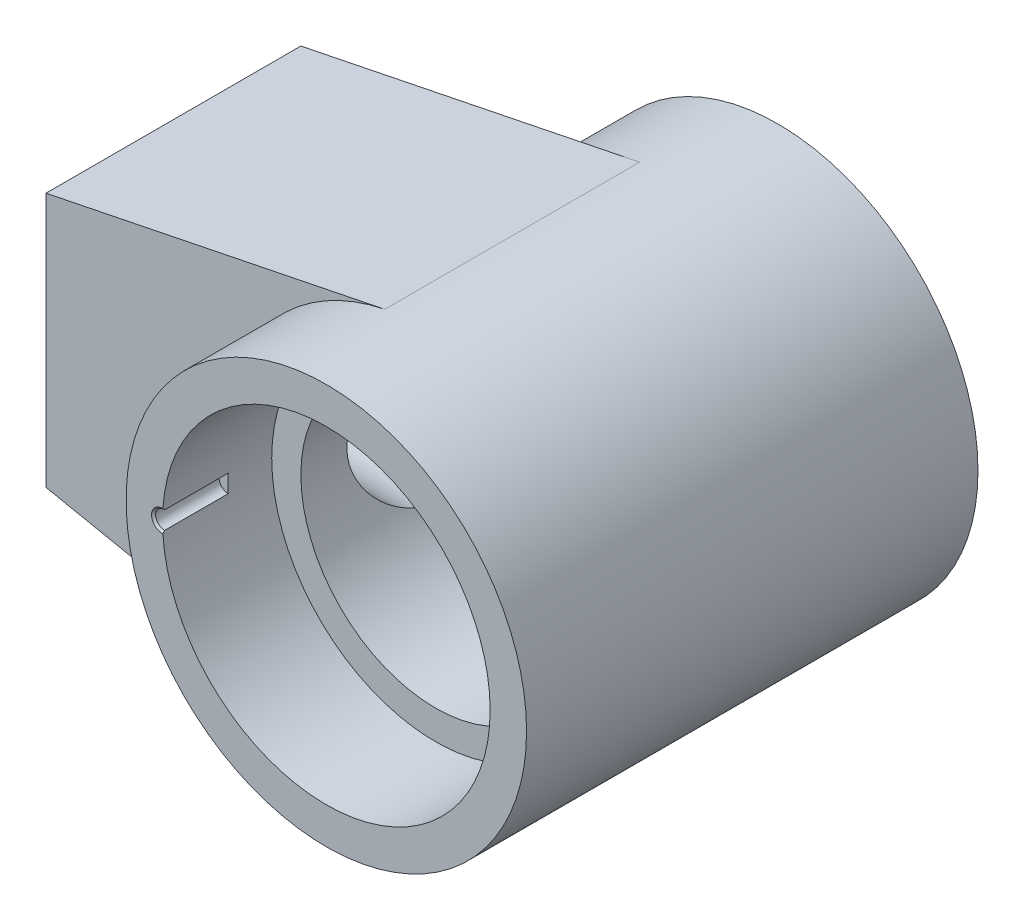
from build123d import *

# Parameters (mm, degrees)
SKETCH_1_R               = 55
EXTRUDE_1_DEPTH          = 62
EXTRUDE_2_DEPTH          = 35
CUT_EXTRUDE_1_DEPTH      = 133.984961556
CUT_EXTRUDE_1_DEPTH_BACK = 133.984961556
SKETCH_3_R               = 37
SKETCH_4_R               = 45
CUT_EXTRUDE_2_DEPTH      = 30
CUT_EXTRUDE_3_REACH      = 181.304
CUT_EXTRUDE_3_END_RADIUS = 37
SKETCH_6_R               = 19.352
CHAMFER_2_SIZE           = 1.648
SKETCH_9_R               = 2.4455
CUT_EXTRUDE_5_DEPTH      = 18
CHAMFER_3_SIZE           = 0.5545


with BuildPart() as part:
    # Эскиз1 → Бобышка-Вытянуть1 (new, symmetric)
    with BuildSketch(Plane.XY):
        Circle(SKETCH_1_R)
    extrude(amount=EXTRUDE_1_DEPTH, both=True)

    # Эскиз2 → Бобышка-Вытянуть2 (add, symmetric)
    with BuildSketch(Plane.XY):
        Polygon((-104, 0), (-104, 35), (-10.947280704, 53.899508766), (-10.947280704, 0), align=None)
    extrude_2 = extrude(amount=EXTRUDE_2_DEPTH, both=True)

    # Зеркальное отражение1: Бобышка-Вытянуть2 across plane
    add(extrude_2.mirror(Plane(origin=(-104, 0, 35), x_dir=(0, 0, 1), z_dir=(0, 1, 0))))

    # Эскиз3 → Вырез-Вытянуть1 (cut, two sides: drawn at the far end of the back side and taken through both)
    with BuildSketch(Plane.XY.offset(-CUT_EXTRUDE_1_DEPTH_BACK)):
        Circle(SKETCH_3_R)
    extrude(amount=CUT_EXTRUDE_1_DEPTH + CUT_EXTRUDE_1_DEPTH_BACK, mode=Mode.SUBTRACT)

    # Эскиз4 → Вырез-Вытянуть2 (cut)
    with BuildSketch(Plane.XY.offset(62)):
        Circle(SKETCH_4_R)
    cut_extrude_2 = extrude(amount=-CUT_EXTRUDE_2_DEPTH, mode=Mode.SUBTRACT)

    # Зеркальное отражение2: Вырез-Вытянуть2 across plane
    add(cut_extrude_2.mirror(Plane.XY), mode=Mode.SUBTRACT)

    # Вырез-Вытянуть3: up to this cylinder (the profile starts outside it)
    cut_extrude_3_end = Plane(origin=(0, 0, 0), z_dir=(0, 0, 1)) * Cylinder(CUT_EXTRUDE_3_END_RADIUS, 437.608, mode=Mode.PRIVATE)
    # Эскиз6 → Вырез-Вытянуть3 (cut, up to the surface)
    with BuildSketch(Plane.ZY.offset(104), mode=Mode.PRIVATE) as cut_extrude_3_sk1:
        Circle(SKETCH_6_R)
    cut_extrude_3_tool1 = extrude(cut_extrude_3_sk1.sketch, amount=-CUT_EXTRUDE_3_REACH, mode=Mode.PRIVATE) - cut_extrude_3_end
    add(cut_extrude_3_tool1.solids().sort_by_distance((-104, 0, 0))[0], mode=Mode.SUBTRACT)

    # Фаска2
    chamfer_2_edges = [part.edges().sort_by_distance(p)[0] for p in [
        (-104, 0, -19.352),
    ]]
    chamfer(chamfer_2_edges, length=CHAMFER_2_SIZE)

    # Эскиз9 → Вырез-Вытянуть5 (cut)
    with BuildSketch(Plane(origin=(0, 0, -62), x_dir=(-1, 0, 0), z_dir=(0, 0, -1))):
        with Locations((45, 0)):
            Circle(SKETCH_9_R)
    cut_extrude_5 = extrude(amount=-CUT_EXTRUDE_5_DEPTH, mode=Mode.SUBTRACT)

    # Зеркальное отражение3: Вырез-Вытянуть5 across plane
    add(cut_extrude_5.mirror(Plane.XY), mode=Mode.SUBTRACT)

    # Фаска3
    chamfer_3_edges = [part.edges().sort_by_distance(p)[0] for p in [
        (-47.4455, 0, -62),
        (-47.4455, 0, 62),
    ]]
    chamfer(chamfer_3_edges, length=CHAMFER_3_SIZE)


solid = part.part
